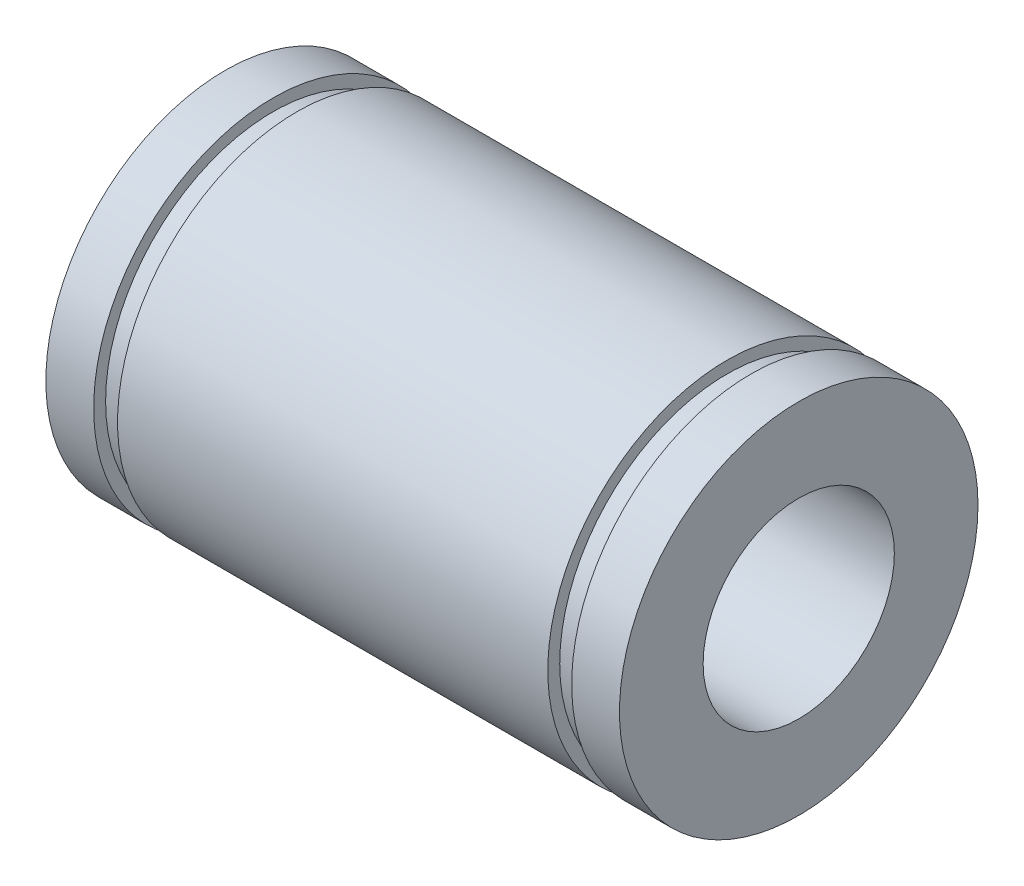
from build123d import *

# Parameters (mm, degrees)
SKETCH1_R           = 7.5
SKETCH1_R_2         = 4
BOSS_EXTRUDE1_DEPTH = 2
SKETCH2_R           = 7
SKETCH2_R_2         = 4
BOSS_EXTRUDE2_DEPTH = 1
SKETCH3_R           = 7.5
SKETCH3_R_2         = 4
BOSS_EXTRUDE3_DEPTH = 18
SKETCH4_R           = 7
SKETCH4_R_2         = 4
BOSS_EXTRUDE4_DEPTH = 1
SKETCH5_R           = 7.5
SKETCH5_R_2         = 4
BOSS_EXTRUDE5_DEPTH = 2


with BuildPart() as part:
    # Sketch1 → Boss-Extrude1 (new body)
    with BuildSketch(Plane(origin=(0, 0, 0), x_dir=(0, 0, -1), z_dir=(1, 0, 0))):
        Circle(SKETCH1_R)
        Circle(SKETCH1_R_2, mode=Mode.SUBTRACT)
    extrude(amount=BOSS_EXTRUDE1_DEPTH)

    # Sketch2 → Boss-Extrude2 (add)
    with BuildSketch(Plane(origin=(2, 0, 0), x_dir=(0, 0, -1), z_dir=(1, 0, 0))):
        Circle(SKETCH2_R)
        Circle(SKETCH2_R_2, mode=Mode.SUBTRACT)
    extrude(amount=BOSS_EXTRUDE2_DEPTH)

    # Sketch3 → Boss-Extrude3 (add)
    with BuildSketch(Plane(origin=(3, 0, 0), x_dir=(0, 0, -1), z_dir=(1, 0, 0))):
        Circle(SKETCH3_R)
        Circle(SKETCH3_R_2, mode=Mode.SUBTRACT)
    extrude(amount=BOSS_EXTRUDE3_DEPTH)

    # Sketch4 → Boss-Extrude4 (add)
    with BuildSketch(Plane(origin=(21, 0, 0), x_dir=(0, 0, -1), z_dir=(1, 0, 0))):
        Circle(SKETCH4_R)
        Circle(SKETCH4_R_2, mode=Mode.SUBTRACT)
    extrude(amount=BOSS_EXTRUDE4_DEPTH)

    # Sketch5 → Boss-Extrude5 (add)
    with BuildSketch(Plane(origin=(22, 0, 0), x_dir=(0, 0, -1), z_dir=(1, 0, 0))):
        Circle(SKETCH5_R)
        Circle(SKETCH5_R_2, mode=Mode.SUBTRACT)
    extrude(amount=BOSS_EXTRUDE5_DEPTH)


solid = part.part
